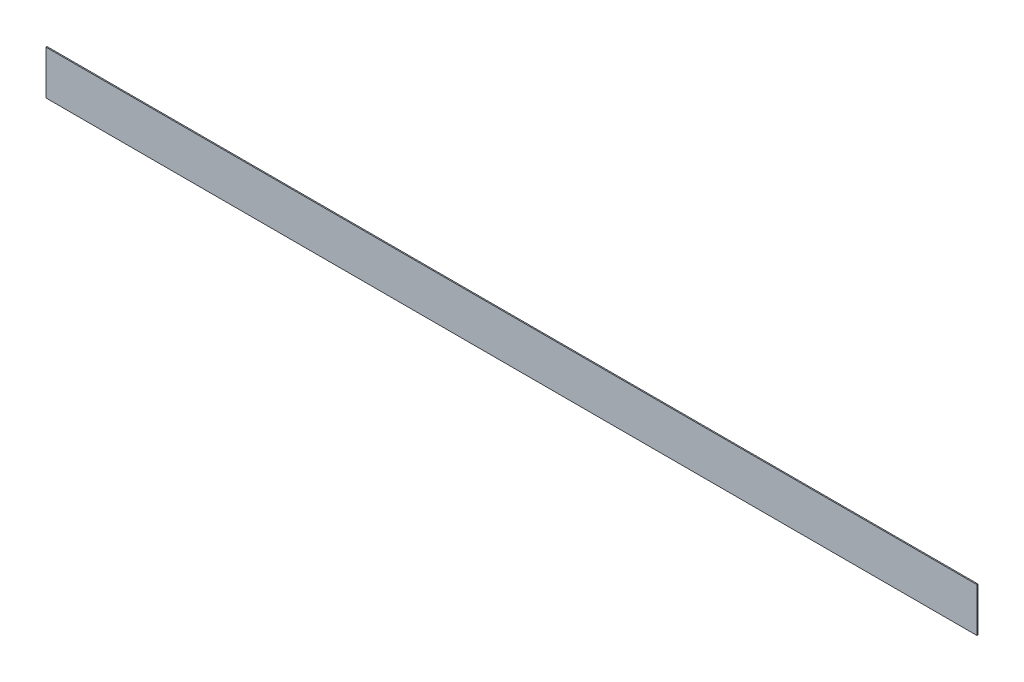
from build123d import *

# Parameters (mm, degrees)
STORE_PANEL_BANT_UST_1_START = 38.5
SKETCH1_W                    = 1268
SKETCH1_H                    = 60
STORE_PANEL_BANT_UST_1_DEPTH = 1.5


with BuildPart() as part:
    # Sketch1 → STORE_panel_bant_ust_1 (new body)
    with BuildSketch(Plane.XY.offset(STORE_PANEL_BANT_UST_1_START)):
        with Locations((700, 1640)):
            Rectangle(SKETCH1_W, SKETCH1_H)
    extrude(amount=STORE_PANEL_BANT_UST_1_DEPTH)


solid = part.part
